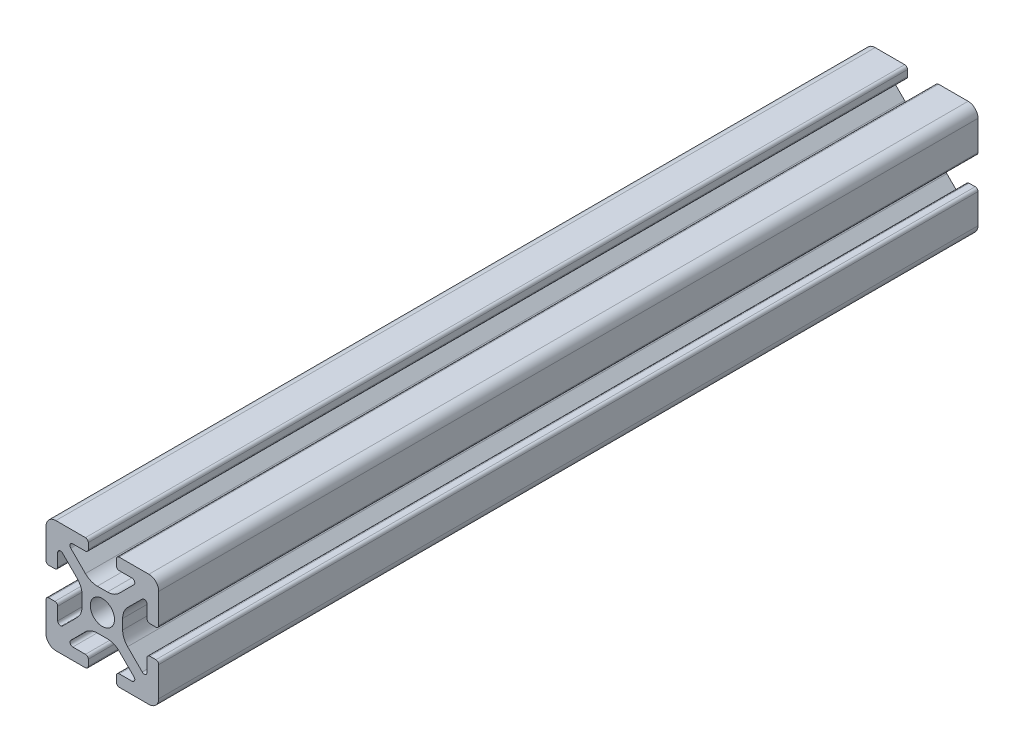
from build123d import *

# Parameters (mm, degrees)
BOSS_EXTRUDE1_DEPTH = 54.5
SCALE1_SCALE_X      = 0.75
SCALE1_SCALE_Y      = 0.75
SCALE1_SCALE_Z      = 1


with BuildPart() as part:
    # Sketch4 → Boss-Extrude1 (new, symmetric)
    with BuildSketch(Plane.XY):
        with BuildLine():
            Line((3, -10), (8.25, -10))
            ThreePointArc((8.25, -10), (9.487436867, -9.487436867), (10, -8.25))
            Line((10, -8.25), (10, -3))
            ThreePointArc((10, -3), (9.853553391, -2.646446609), (9.5, -2.5))
            Line((9.5, -2.5), (8.424621202, -2.5))
            ThreePointArc((8.424621202, -2.5), (8.071067812, -2.646446609), (7.924621202, -3))
            Line((7.924621202, -3), (7.924621202, -5.25))
            ThreePointArc((7.924621202, -5.25), (7.615962919, -5.711939766), (7.071067812, -5.603553391))
            Line((7.071067812, -5.603553391), (4.478679656, -3.011165235))
            ThreePointArc((4.478679656, -3.011165235), (3.828361402, -2.037895189), (3.6, -0.889844892))
            Line((3.6, -0.889844892), (3.6, 0))
            Line((3.6, 0), (2.15, 0))
            ThreePointArc((2.15, 0), (1.52027958, -1.52027958), (0, -2.15))
            Line((0, -2.15), (0, -3.6))
            Line((0, -3.6), (0.889844892, -3.6))
            ThreePointArc((0.889844892, -3.6), (2.037895189, -3.828361402), (3.011165235, -4.478679656))
            Line((3.011165235, -4.478679656), (5.603553391, -7.071067812))
            ThreePointArc((5.603553391, -7.071067812), (5.711939766, -7.615962919), (5.25, -7.924621202))
            Line((5.25, -7.924621202), (3, -7.924621202))
            ThreePointArc((3, -7.924621202), (2.646446609, -8.071067812), (2.5, -8.424621202))
            Line((2.5, -8.424621202), (2.5, -9.5))
            ThreePointArc((2.5, -9.5), (2.646446609, -9.853553391), (3, -10))
        make_face()
    extrude(amount=BOSS_EXTRUDE1_DEPTH, both=True)

    # Mirror1: part across plane


with BuildPart() as part_1:
    add(part.part)
    add(part.part.mirror(Plane(origin=(0, 0, 0), x_dir=(0, 0, 1), z_dir=(1, 0, 0))))

    # Mirror2: part across plane


with BuildPart() as part_2:
    add(part_1.part)
    add(part_1.part.mirror(Plane.ZX))


with BuildPart() as part_3:
    # Scale1: scaled about (0, 0, 0)
    add(part_2.part.scale((SCALE1_SCALE_X, SCALE1_SCALE_Y, SCALE1_SCALE_Z), about=(0, 0, 0)))


solid = part_3.part
